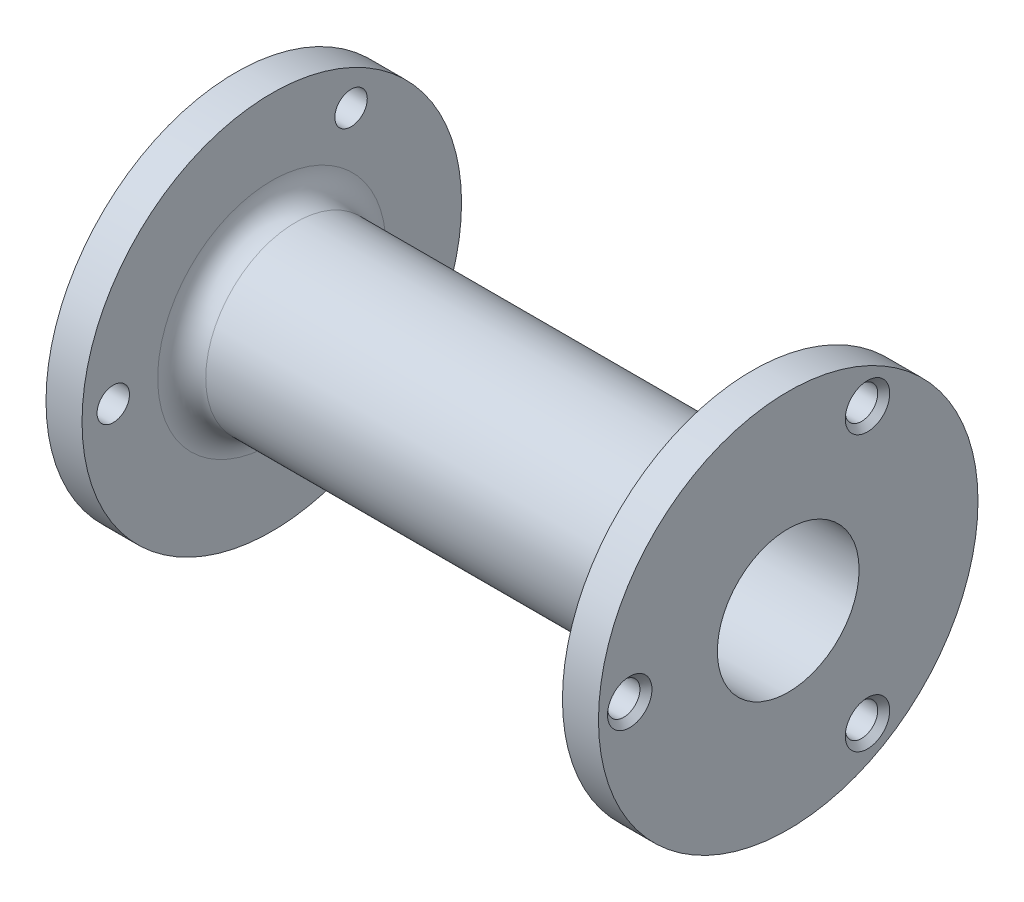
from build123d import *

# Parameters (mm, degrees)
SKETCH3_R          = 1.35
CUT_EXTRUDE1_DEPTH = 52.139808369
CHAMFER1_SIZE      = 0.5


with BuildPart() as part:
    # Sketch1 → Revolve1 (revolve)
    with BuildSketch(Plane.XY, mode=Mode.PRIVATE) as revolve1_sk:
        with BuildLine():
            Line((0, 5.9), (0, 15.8))
            Line((0, 15.8), (3, 15.8))
            Line((3, 15.8), (3, 9.5))
            ThreePointArc((3, 9.5), (3.585786438, 8.085786438), (5, 7.5))
            Line((5, 7.5), (41, 7.5))
            ThreePointArc((41, 7.5), (42.414213562, 8.085786438), (43, 9.5))
            Line((43, 9.5), (43, 15.8))
            Line((43, 15.8), (46, 15.8))
            Line((46, 15.8), (46, 5.9))
            Line((46, 5.9), (43, 5.9))
            Line((43, 5.9), (3, 5.9))
            Line((3, 5.9), (0, 5.9))
        make_face()
    revolve(revolve1_sk.sketch.rotate(Axis((0, 0, 0), (-1, 0, 0)), 90), axis=Axis((0, 0, 0), (-1, 0, 0)))

    # Sketch3 → Cut-Extrude1 (cut, through all)
    with BuildSketch(Plane(origin=(46, 0, 0), x_dir=(0, 0, -1), z_dir=(1, 0, 0))):
        with Locations((-13.2, 0)):
            Circle(SKETCH3_R)
        with Locations((6.6, 11.43153533)):
            Circle(SKETCH3_R)
        with Locations((6.6, -11.43153533)):
            Circle(SKETCH3_R)
    extrude(amount=-CUT_EXTRUDE1_DEPTH, mode=Mode.SUBTRACT)

    # Chamfer1
    chamfer1_edges = [part.edges().sort_by_distance(p)[0] for p in [
        (0, 0, 14.55),
        (46, 0, 14.55),
        (0, 11.43153533, -5.25),
        (46, 11.43153533, -5.25),
        (0, -11.43153533, -5.25),
        (46, -11.43153533, -5.25),
    ]]
    chamfer(chamfer1_edges, length=CHAMFER1_SIZE)


solid = part.part
